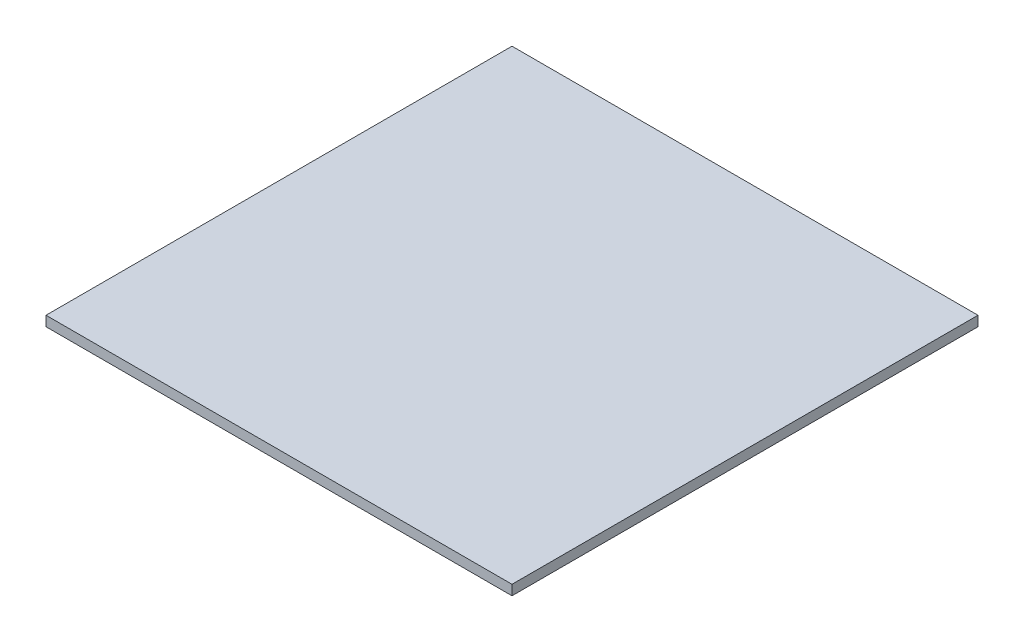
from build123d import *

# Parameters (mm, degrees)
SKETCH1_W           = 280
SKETCH1_H           = 280
BOSS_EXTRUDE1_DEPTH = 6


with BuildPart() as part:
    # Sketch1 → Boss-Extrude1 (new body)
    with BuildSketch(Plane(origin=(0, 0, 0), x_dir=(1, 0, 0), z_dir=(0, 1, 0))):
        with Locations((140, 140)):
            Rectangle(SKETCH1_W, SKETCH1_H)
    extrude(amount=BOSS_EXTRUDE1_DEPTH)


solid = part.part
